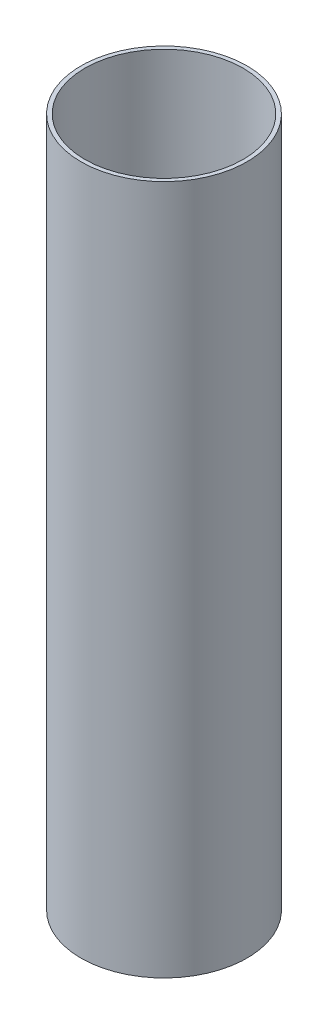
from build123d import *

# Parameters (mm, degrees)
SKETCH1_R           = 6.3
BOSS_EXTRUDE1_DEPTH = 0.3
SKETCH2_R           = 6.3
SKETCH2_R_2         = 6
BOSS_EXTRUDE2_DEPTH = 52


with BuildPart() as part:
    # Sketch1 → Boss-Extrude1 (new body)
    with BuildSketch(Plane(origin=(0, 0, 0), x_dir=(1, 0, 0), z_dir=(0, 1, 0))):
        with Locations(Location((0, 0, 0), (0, 0, 270))):
            Circle(SKETCH1_R)
    extrude(amount=BOSS_EXTRUDE1_DEPTH)

    # Sketch2 → Boss-Extrude2 (add)
    with BuildSketch(Plane(origin=(0, 0.3, 0), x_dir=(1, 0, 0), z_dir=(0, 1, 0))):
        with Locations(Location((0, 0, 0), (0, 0, 270))):
            Circle(SKETCH2_R)
        with Locations(Location((0, 0, 0), (0, 0, 90))):
            Circle(SKETCH2_R_2, mode=Mode.SUBTRACT)
    extrude(amount=BOSS_EXTRUDE2_DEPTH)


solid = part.part
